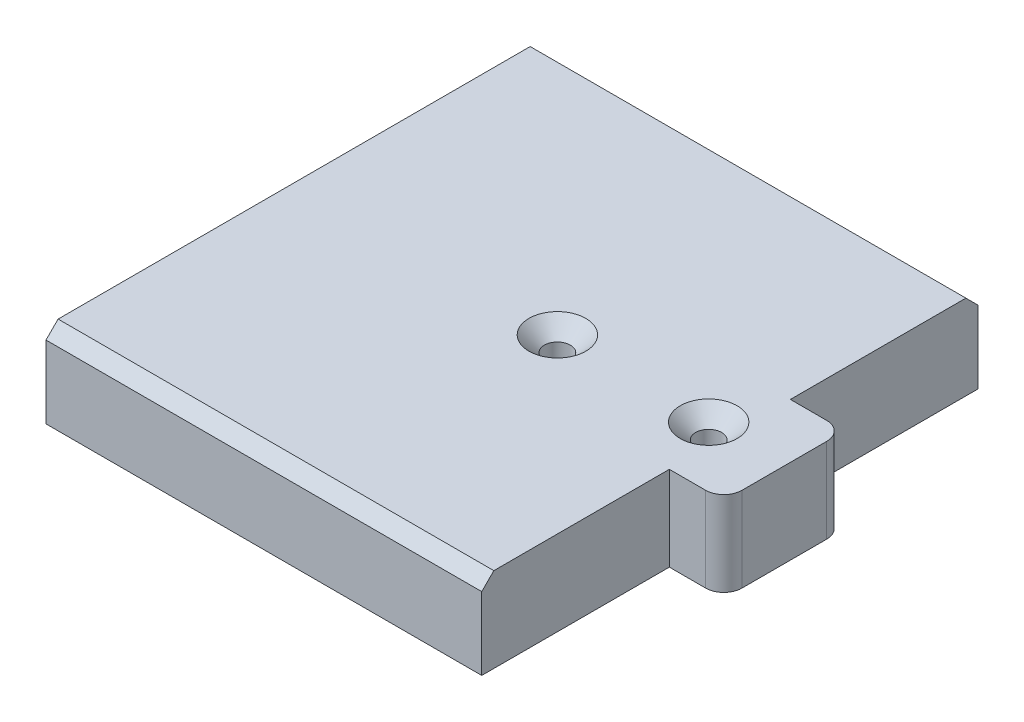
from build123d import *

# Parameters (mm, degrees)
ESQUISSE2_W                                    = 72
ESQUISSE2_H                                    = 14
BOSS_EXTRU_1_DEPTH                             = 41
ESQUISSE12_W                                   = 9
ESQUISSE12_H                                   = 20
BOSS_EXTRU_6_DEPTH                             = 14
FRAISAGE_POUR_VIS_T_TE_FRAIS_E_M41_D           = 4.3
FRAISAGE_POUR_VIS_T_TE_FRAIS_E_M41_CSINK_D     = 9.4
FRAISAGE_POUR_VIS_T_TE_FRAIS_E_M41_CSINK_ANGLE = 90
ENL_V_MAT_EXTRU_3_REACH                        = 95.798
ESQUISSE6_W                                    = 20
ESQUISSE6_H                                    = 10
ESQUISSE5_W                                    = 5.5
ESQUISSE5_H                                    = 50
ENL_V_MAT_EXTRU_2_DEPTH                        = 7
CHANFREIN1_SIZE                                = 2
ESQUISSE16_W                                   = 20
ESQUISSE16_H                                   = 7
BOSS_EXTRU_7_DEPTH                             = 10
CONG_1_R                                       = 3


with BuildPart() as part:
    # Esquisse2 → Boss.-Extru.1 (new, symmetric)
    with BuildSketch(Plane.XY):
        Rectangle(ESQUISSE2_W, ESQUISSE2_H)
    extrude(amount=BOSS_EXTRU_1_DEPTH, both=True)

    # Esquisse12 → Boss.-Extru.6 (add)
    with BuildSketch(Plane(origin=(0, 7, 0), x_dir=(1, 0, 0), z_dir=(0, 1, 0))):
        with Locations((40.5, 0)):
            Rectangle(ESQUISSE12_W, ESQUISSE12_H)
    extrude(amount=-BOSS_EXTRU_6_DEPTH)

    # Fraisage pour vis à tête fraisée M41 (through all)
    with Locations(Plane(origin=(0, 7, 0), x_dir=(1, 0, 0), z_dir=(0, 1, 0))):
        with Locations((32.5, 0), (7.5, 0)):
            CounterSinkHole(FRAISAGE_POUR_VIS_T_TE_FRAIS_E_M41_D / 2, FRAISAGE_POUR_VIS_T_TE_FRAIS_E_M41_CSINK_D / 2, counter_sink_angle=FRAISAGE_POUR_VIS_T_TE_FRAIS_E_M41_CSINK_ANGLE)

    # Esquisse6 → Enlèv. mat.-Extru.3 (cut, up to next)
    with BuildSketch(Plane.XY.offset(-41), mode=Mode.PRIVATE) as enl_v_mat_extru_3_sk1:
        with Locations((-18, -2)):
            Rectangle(ESQUISSE6_W, ESQUISSE6_H)
    enl_v_mat_extru_3_tool1 = extrude(enl_v_mat_extru_3_sk1.sketch, amount=ENL_V_MAT_EXTRU_3_REACH, mode=Mode.PRIVATE) & part.part
    add(enl_v_mat_extru_3_tool1.solids().sort_by_distance((-18, -2, -41))[0], mode=Mode.SUBTRACT)

    # Esquisse5 → Enlèv. mat.-Extru.2 (cut)
    with BuildSketch(Plane(origin=(0, -7, 0), x_dir=(1, 0, 0), z_dir=(0, 1, 0))):
        with Locations((-33.25, 0)):
            Rectangle(ESQUISSE5_W, ESQUISSE5_H)
    extrude(amount=ENL_V_MAT_EXTRU_2_DEPTH, mode=Mode.SUBTRACT)

    # Chanfrein1
    chanfrein1_edges = [part.edges().sort_by_distance(p)[0] for p in [
        (0, 7, -41),
        (0, 7, 41),
    ]]
    chamfer(chanfrein1_edges, length=CHANFREIN1_SIZE)

    # Esquisse16 → Boss.-Extru.7 (add)
    with BuildSketch(Plane.XZ.offset(-3)):
        with Locations((-18, -37.5)):
            Rectangle(ESQUISSE16_W, ESQUISSE16_H)
    boss_extru_7 = extrude(amount=BOSS_EXTRU_7_DEPTH)

    # Symétrie1: Boss.-Extru.7 across plane
    add(boss_extru_7.mirror(Plane.XY))

    # Congé1
    cong_1_edges = [part.edges().sort_by_distance(p)[0] for p in [
        (45, 0, 10),
        (45, 0, -10),
    ]]
    fillet(cong_1_edges, radius=CONG_1_R)


solid = part.part
